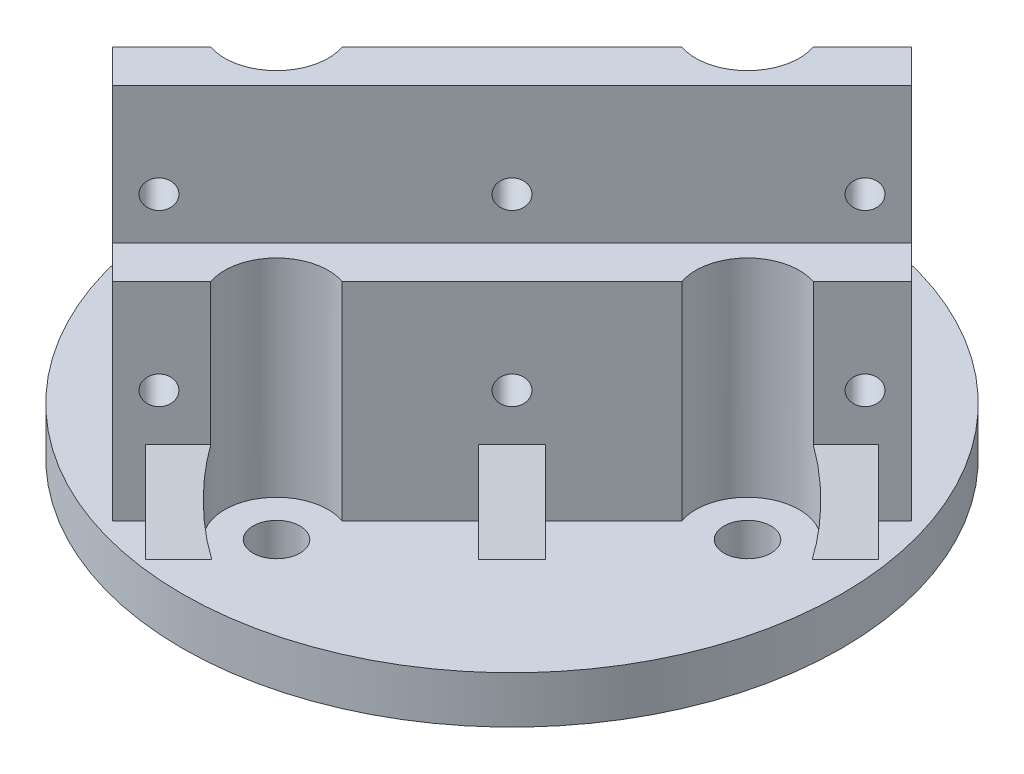
from build123d import *

# Parameters (mm, degrees)
SKETCH_1_R                 = 35
SKETCH_1_R_2               = 2.5
EXTRUDE_1_DEPTH            = 5
EXTRUDE_2_DEPTH            = 30
EXTRUDE_3_DEPTH            = 2.5
PATTERN_LINEAR_1_COUNT     = 2
PATTERN_LINEAR_1_PITCH     = 25
PATTERN_LINEAR_1_COL_COUNT = 2
PATTERN_LINEAR_1_COL_PITCH = 25
MIRROR_1_COPY_1_DEPTH      = 2.5
MIRROR_1_COPY_2_DEPTH      = 2.5
CUT_EXTRUDE_1_REACH        = 56.166
SKETCH_5_R                 = 5.5
SKETCH_6_R                 = 1.5
CUT_EXTRUDE_2_DEPTH        = 71.151518001


with BuildPart() as part:
    # 草圖1 → 填料-伸長1 (new body)
    with BuildSketch(Plane(origin=(0, 0, 0), x_dir=(1, 0, 0), z_dir=(0, 1, 0))):
        with Locations(Location((0, 0, 0), (0, 0, 270))):
            Circle(SKETCH_1_R)
        with Locations(Location((0, 25, 0), (0, 0, 270))):
            Circle(SKETCH_1_R_2, mode=Mode.SUBTRACT)
        with Locations(Location((25, 0, 0), (0, 0, 270))):
            Circle(SKETCH_1_R_2, mode=Mode.SUBTRACT)
        with Locations(Location((0, -25, 0), (0, 0, 270))):
            Circle(SKETCH_1_R_2, mode=Mode.SUBTRACT)
        with Locations(Location((-25, 0, 0), (0, 0, 270))):
            Circle(SKETCH_1_R_2, mode=Mode.SUBTRACT)
    extrude(amount=EXTRUDE_1_DEPTH)

    # 草圖3 → 填料-伸長2 (add, symmetric)
    with BuildSketch(Plane(origin=(0, 0, 0), x_dir=(-0.7071067811865477, 0, -0.7071067811865474), z_dir=(0.7071067811865474, 0, -0.7071067811865477))):
        Polygon((15.25, 5), (-15.25, 5), (-15.25, 27), (-10.25, 27), (-10.25, 7), (10.25, 7), (10.25, 27), (15.25, 27), align=None)
    extrude(amount=EXTRUDE_2_DEPTH, both=True)

    # 草圖4 → 填料-伸長3 (add, symmetric)
    with BuildSketch(Plane(origin=(0, 0, 0), x_dir=(-0.7071067811865477, 0, -0.7071067811865474), z_dir=(0.7071067811865474, 0, -0.7071067811865477))):
        Polygon((-15.25, 12), (-15.25, 5), (-20.25, 5), align=None)
    extrude_3 = extrude(amount=EXTRUDE_3_DEPTH, both=True)

    # 直線複製排列1: 填料-伸長3 ×2
    with Locations(*[Vector(-0.7071067811865474, 0, 0.7071067811865478) * (i * PATTERN_LINEAR_1_PITCH) for i in range(1, PATTERN_LINEAR_1_COUNT)]):
        add(extrude_3)

    # 直線複製排列1 col: 填料-伸長3 ×2
    with Locations(*[Vector(0.7071067811865474, 0, -0.7071067811865478) * (i * PATTERN_LINEAR_1_COL_PITCH) for i in range(1, PATTERN_LINEAR_1_COL_COUNT)]):
        add(extrude_3)

    # 鏡射1: 填料-伸長3 across plane
    add(extrude_3.mirror(Plane(origin=(0, 0, 0), x_dir=(-0.7071067811865474, 0, 0.7071067811865477), z_dir=(0.7071067811865477, 0, 0.7071067811865474))))

    # 鏡射1 copy 1 sketch → 鏡射1 copy 1 (add, symmetric)
    with BuildSketch(Plane(origin=(-17.67766953, 0, 17.67766953), x_dir=(0.7071067811865477, 0, 0.7071067811865474), z_dir=(0.7071067811865474, 0, -0.7071067811865477))):
        Polygon((-15.25, -12), (-15.25, -5), (-20.25, -5), align=None)
    extrude(amount=MIRROR_1_COPY_1_DEPTH, both=True)

    # 鏡射1 copy 2 sketch → 鏡射1 copy 2 (add, symmetric)
    with BuildSketch(Plane(origin=(17.67766953, 0, -17.67766953), x_dir=(0.7071067811865477, 0, 0.7071067811865474), z_dir=(0.7071067811865474, 0, -0.7071067811865477))):
        Polygon((-15.25, -12), (-15.25, -5), (-20.25, -5), align=None)
    extrude(amount=MIRROR_1_COPY_2_DEPTH, both=True)

    # 除料-伸長1: up to this face of the body (flat: up to its plane)
    cut_extrude_1_end = Plane(part.part.faces().sort_by_distance((-9.01561146, 27, -9.01561146))[0])
    # 草圖5 → 除料-伸長1 (cut, up to the picked face)
    with BuildSketch(Plane(origin=(0, 5, 0), x_dir=(1, 0, 0), z_dir=(0, 1, 0)), mode=Mode.PRIVATE) as cut_extrude_1_sk1:
        with Locations((0, 25)):
            Circle(SKETCH_5_R)
    cut_extrude_1_tool1 = split(extrude(cut_extrude_1_sk1.sketch, amount=CUT_EXTRUDE_1_REACH, mode=Mode.PRIVATE), bisect_by=cut_extrude_1_end, keep=Keep.BOTH, mode=Mode.PRIVATE)
    # 草圖5 → 除料-伸長1 (cut, up to the picked face)
    with BuildSketch(Plane(origin=(0, 5, 0), x_dir=(1, 0, 0), z_dir=(0, 1, 0)), mode=Mode.PRIVATE) as cut_extrude_1_sk2:
        with Locations((-25, 0)):
            Circle(SKETCH_5_R)
    cut_extrude_1_tool2 = split(extrude(cut_extrude_1_sk2.sketch, amount=CUT_EXTRUDE_1_REACH, mode=Mode.PRIVATE), bisect_by=cut_extrude_1_end, keep=Keep.BOTH, mode=Mode.PRIVATE)
    # 草圖5 → 除料-伸長1 (cut, up to the picked face)
    with BuildSketch(Plane(origin=(0, 5, 0), x_dir=(1, 0, 0), z_dir=(0, 1, 0)), mode=Mode.PRIVATE) as cut_extrude_1_sk3:
        with Locations((0, -25)):
            Circle(SKETCH_5_R)
    cut_extrude_1_tool3 = split(extrude(cut_extrude_1_sk3.sketch, amount=CUT_EXTRUDE_1_REACH, mode=Mode.PRIVATE), bisect_by=cut_extrude_1_end, keep=Keep.BOTH, mode=Mode.PRIVATE)
    # 草圖5 → 除料-伸長1 (cut, up to the picked face)
    with BuildSketch(Plane(origin=(0, 5, 0), x_dir=(1, 0, 0), z_dir=(0, 1, 0)), mode=Mode.PRIVATE) as cut_extrude_1_sk4:
        with Locations((25, 0)):
            Circle(SKETCH_5_R)
    cut_extrude_1_tool4 = split(extrude(cut_extrude_1_sk4.sketch, amount=CUT_EXTRUDE_1_REACH, mode=Mode.PRIVATE), bisect_by=cut_extrude_1_end, keep=Keep.BOTH, mode=Mode.PRIVATE)
    add(cut_extrude_1_tool1.solids().sort_by(Axis((0, 5, -25), (0, 1, 0)))[0], mode=Mode.SUBTRACT)
    add(cut_extrude_1_tool2.solids().sort_by(Axis((-25, 5, 0), (0, 1, 0)))[0], mode=Mode.SUBTRACT)
    add(cut_extrude_1_tool3.solids().sort_by(Axis((0, 5, 25), (0, 1, 0)))[0], mode=Mode.SUBTRACT)
    add(cut_extrude_1_tool4.solids().sort_by(Axis((25, 5, 0), (0, 1, 0)))[0], mode=Mode.SUBTRACT)

    # 草圖6 → 除料-伸長2 (cut, through all)
    with BuildSketch(Plane(origin=(-10.783378413, 0, -10.783378413), x_dir=(-0.7071067811865474, 0, 0.7071067811865477), z_dir=(-0.7071067811865477, 0, -0.7071067811865474))):
        with Locations((0, 17)):
            Circle(SKETCH_6_R)
        with Locations((-26.5, 17)):
            Circle(SKETCH_6_R)
        with Locations((26.5, 17)):
            Circle(SKETCH_6_R)
    extrude(amount=-CUT_EXTRUDE_2_DEPTH, mode=Mode.SUBTRACT)


solid = part.part
